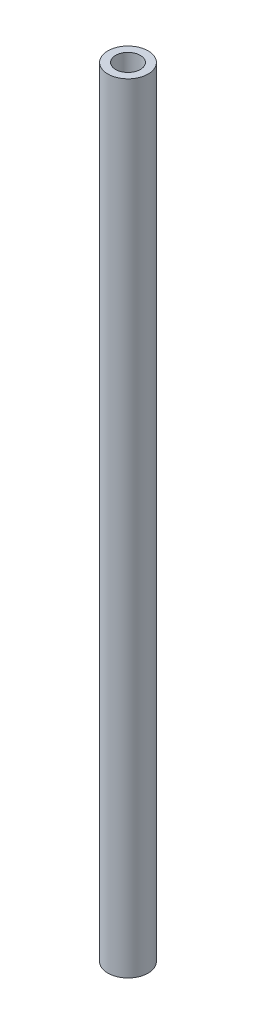
from build123d import *

# Parameters (mm, degrees)
SKETCH1_R           = 1.55
SKETCH1_R_2         = 0.95
BOSS_EXTRUDE1_DEPTH = 60


with BuildPart() as part:
    # Sketch1 → Boss-Extrude1 (new body)
    with BuildSketch(Plane(origin=(0, 0, 0), x_dir=(1, 0, 0), z_dir=(0, 1, 0))):
        with Locations(Location((0, 0, 0), (0, 0, 270))):
            Circle(SKETCH1_R)
        with Locations(Location((0, 0, 0), (0, 0, 270))):
            Circle(SKETCH1_R_2, mode=Mode.SUBTRACT)
    extrude(amount=BOSS_EXTRUDE1_DEPTH)


solid = part.part
